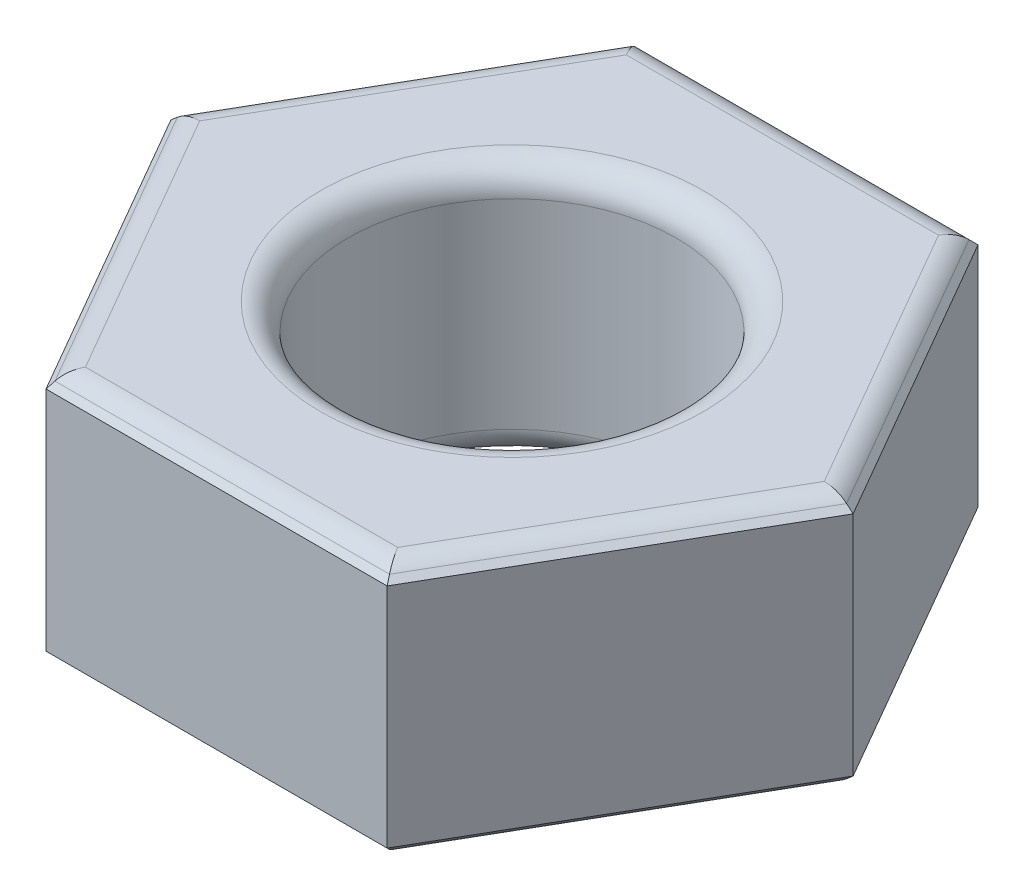
from build123d import *

# Parameters (mm, degrees)
SKETCH1_R           = 1.5
BOSS_EXTRUDE1_DEPTH = 2.325
CHAMFER1_SIZE       = 0.125
FILLET1_R           = 0.25


with BuildPart() as part:
    # Sketch1 → Boss-Extrude1 (new body)
    with BuildSketch(Plane(origin=(0, 0, 0), x_dir=(1, 0, 0), z_dir=(0, 1, 0))):
        Polygon((3.117691454, 0), (1.558845727, 2.7), (-1.558845727, 2.7), (-3.117691454, 0), (-1.558845727, -2.7), (1.558845727, -2.7), align=None)
        with Locations(Location((0, 0, 0), (0, 0, 270))):
            Circle(SKETCH1_R, mode=Mode.SUBTRACT)
    extrude(amount=BOSS_EXTRUDE1_DEPTH)

    # Chamfer1
    chamfer1_edges = [part.edges().sort_by_distance(p)[0] for p in [
        (0, 2.325, -2.7),
        (-2.33826859, 2.325, -1.35),
        (-2.33826859, 2.325, 1.35),
        (0, 2.325, 2.7),
        (2.33826859, 2.325, 1.35),
        (0, 0, 2.7),
        (-2.33826859, 0, 1.35),
        (-2.33826859, 0, -1.35),
        (0, 0, -2.7),
        (2.33826859, 0, -1.35),
        (2.33826859, 0, 1.35),
        (2.33826859, 2.325, -1.35),
    ]]
    chamfer(chamfer1_edges, length=CHAMFER1_SIZE)

    # Fillet1
    fillet1_edges = [part.edges().sort_by_distance(p)[0] for p in [
        (0, 0, -1.5),
        (0, 2.325, -1.5),
        (-2.230015415, 0, 1.2875),
        (0, 0, 2.575),
        (2.230015415, 0, 1.2875),
        (-2.230015415, 0, -1.2875),
        (0, 0, -2.575),
        (2.230015415, 0, -1.2875),
        (-2.230015415, 2.325, 1.2875),
        (-2.230015415, 2.325, -1.2875),
        (0, 2.325, -2.575),
        (2.230015415, 2.325, -1.2875),
        (2.230015415, 2.325, 1.2875),
        (0, 2.325, 2.575),
    ]]
    fillet(fillet1_edges, radius=FILLET1_R)


solid = part.part
